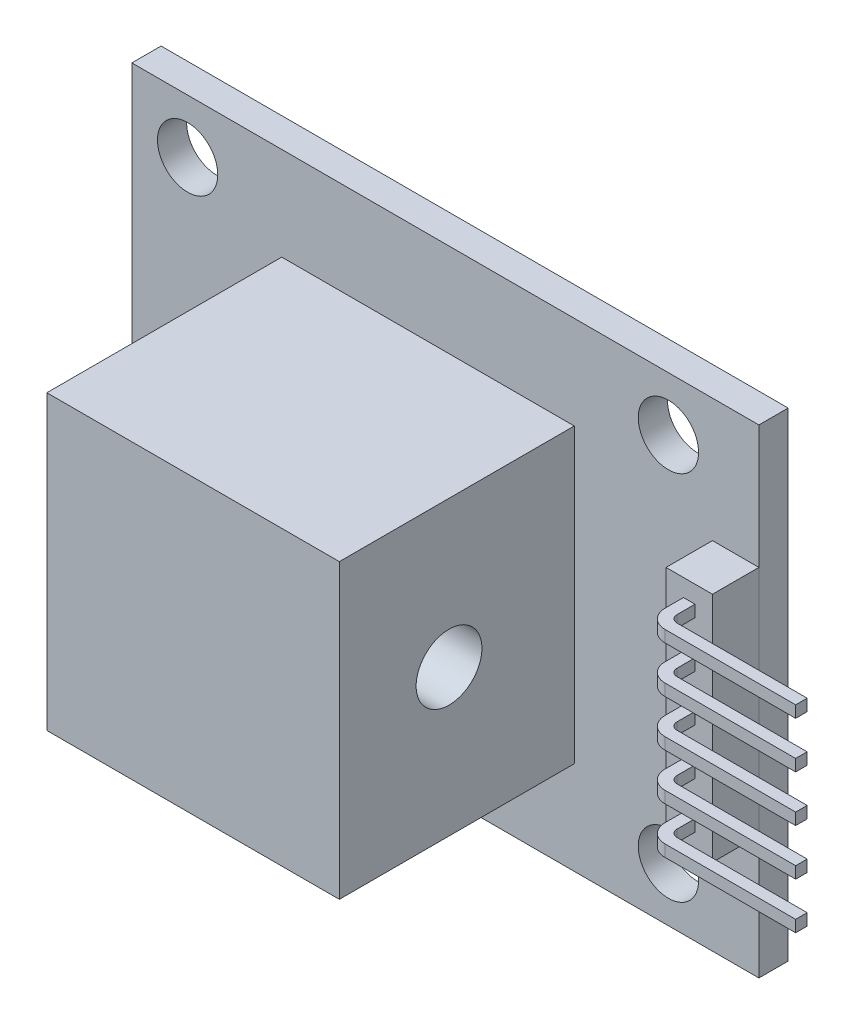
from build123d import *

# Parameters (mm, degrees)
SKETCH1_W             = 34.3
SKETCH1_H             = 26.2
SKETCH1_R             = 1.65
PCB_DEPTH             = 1.6
SKETCH2_W             = 16
SKETCH2_H             = 16
POTENTIOMETERS_DEPTH  = 12.85
SKETCH4_R             = 1.8
ROTATION_AXIS_DEPTH   = 32.081385104
SKETCH5_W             = 2.54
SKETCH5_H             = 12.7
HEADER_BASE_DEPTH     = 2.54
RIGHT_ANGLE_PIN_DEPTH = 0.32
LPATTERN1_COUNT       = 5
LPATTERN1_PITCH       = 2.54


with BuildPart() as part:
    # Sketch1 → PCB (new body)
    with BuildSketch(Plane.XY):
        Rectangle(SKETCH1_W, SKETCH1_H)
        with Locations((-14.1, 10.15)):
            Circle(SKETCH1_R, mode=Mode.SUBTRACT)
        with Locations((12.2, 10.15)):
            Circle(SKETCH1_R, mode=Mode.SUBTRACT)
        with Locations((12.2, -10.15)):
            Circle(SKETCH1_R, mode=Mode.SUBTRACT)
        with Locations((-14.1, -10.15)):
            Circle(SKETCH1_R, mode=Mode.SUBTRACT)
    extrude(amount=PCB_DEPTH)


with BuildPart() as body_2:
    # Sketch2 → Potentiometers (new body)
    with BuildSketch(Plane.XY.offset(1.6)):
        with Locations((-0.95, 0)):
            Rectangle(SKETCH2_W, SKETCH2_H)
    extrude(amount=POTENTIOMETERS_DEPTH)

    # Sketch4 → Rotation Axis (cut, through all)
    with BuildSketch(Plane(origin=(7.05, 0, 0), x_dir=(0, 0, -1), z_dir=(1, 0, 0))):
        with Locations((-8.45, 0)):
            Circle(SKETCH4_R)
    extrude(amount=-ROTATION_AXIS_DEPTH, mode=Mode.SUBTRACT)


with BuildPart() as body_3:
    # Sketch5 → Header Base (new body)
    with BuildSketch(Plane.XY.offset(1.6)):
        with Locations((15.88, 0)):
            Rectangle(SKETCH5_W, SKETCH5_H)
    extrude(amount=HEADER_BASE_DEPTH)

    # Sketch6 → Right Angle Pin (add, symmetric)
    with BuildSketch(Plane(origin=(0, -5.08, 0), x_dir=(-1, 0, 0), z_dir=(0, -1, 0))):
        with BuildLine():
            Line((-15.565, -4.14), (-15.565, -5.155))
            ThreePointArc((-15.565, -5.155), (-15.857893219, -5.862106781), (-16.565, -6.155))
            Line((-16.565, -6.155), (-23.715, -6.155))
            Line((-23.715, -6.155), (-23.715, -5.525))
            Line((-23.715, -5.525), (-16.595, -5.525))
            ThreePointArc((-16.595, -5.525), (-16.312157288, -5.407842712), (-16.195, -5.125))
            Line((-16.195, -5.125), (-16.195, -4.14))
            Line((-16.195, -4.14), (-15.565, -4.14))
        make_face()
    right_angle_pin = extrude(amount=RIGHT_ANGLE_PIN_DEPTH, both=True)

    # LPattern1: Right Angle Pin ×5
    with Locations(*[(0, i * LPATTERN1_PITCH, 0) for i in range(1, LPATTERN1_COUNT)]):
        add(right_angle_pin)


solid = Compound([part.part, body_2.part, body_3.part])
